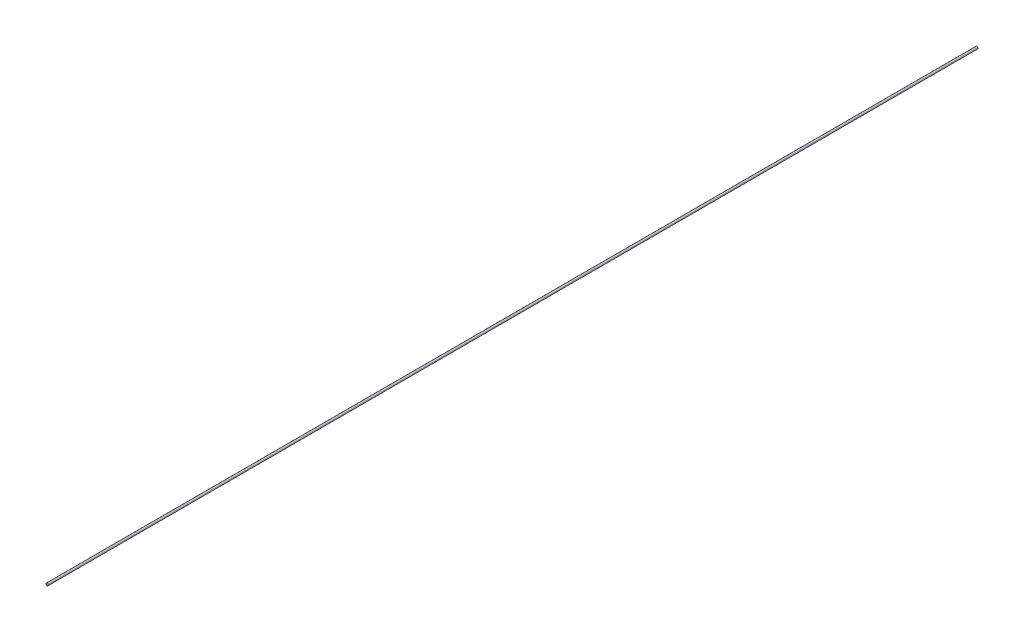
from build123d import *

# Parameters (mm, degrees)
SKETCH2_R           = 0.2159
BOSS_EXTRUDE1_DEPTH = 177.8


with BuildPart() as part:
    # Sketch2 → Boss-Extrude1 (new body)
    with BuildSketch(Plane.XY):
        Circle(SKETCH2_R)
    extrude(amount=BOSS_EXTRUDE1_DEPTH)


solid = part.part
